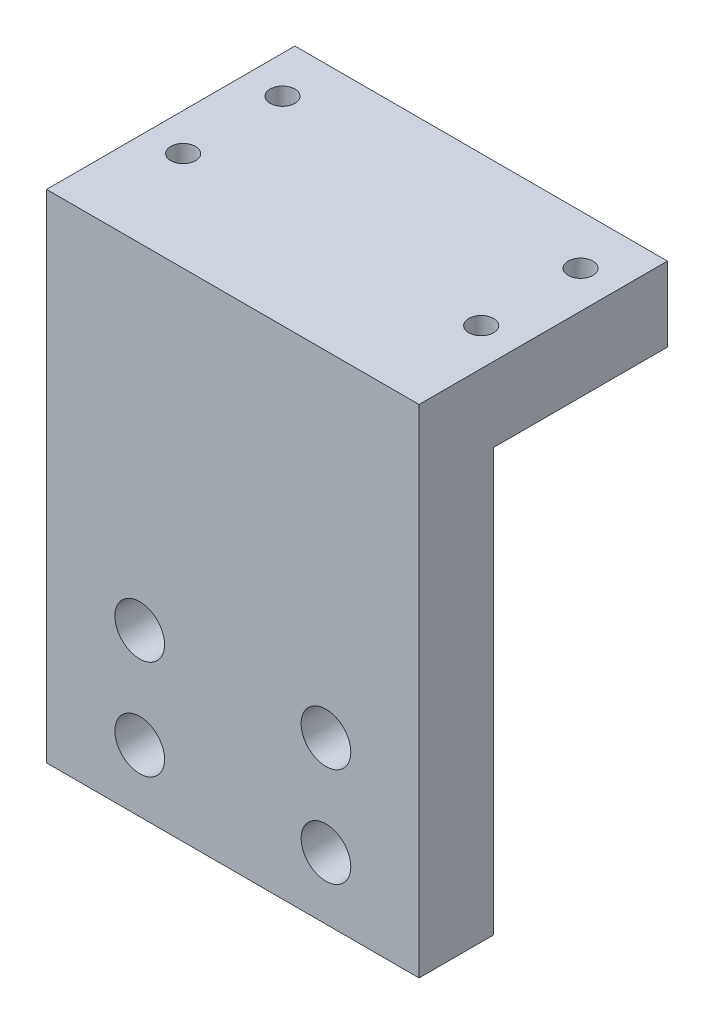
from build123d import *

# Parameters (mm, degrees)
BOSS_EXTRUDE1_DEPTH = 150
SKETCH2_R           = 10
CUT_EXTRUDE1_DEPTH  = 150
SKETCH3_R           = 5
CUT_EXTRUDE2_DEPTH  = 273.07833604


with BuildPart() as part:
    # Sketch1 → Boss-Extrude1 (new body)
    with BuildSketch(Plane(origin=(0, 0, 0), x_dir=(0, 0, -1), z_dir=(1, 0, 0))):
        Polygon((7.362101983, -50), (7.362101983, 150), (107.362101983, 150), (107.362101983, 120), (37.362101983, 120), (37.362101983, -50), align=None)
    extrude(amount=BOSS_EXTRUDE1_DEPTH)

    # Sketch2 → Cut-Extrude1 (cut)
    with BuildSketch(Plane.XY.offset(-7.362101983)):
        with Locations((37.5, -25)):
            Circle(SKETCH2_R)
        with Locations((37.5, 15)):
            Circle(SKETCH2_R)
        with Locations((112.5, -25)):
            Circle(SKETCH2_R)
        with Locations((112.5, 15)):
            Circle(SKETCH2_R)
    extrude(amount=-CUT_EXTRUDE1_DEPTH, mode=Mode.SUBTRACT)

    # Sketch3 → Cut-Extrude2 (cut, through all)
    with BuildSketch(Plane(origin=(0, 150, 0), x_dir=(1, 0, 0), z_dir=(0, 1, 0))):
        with Locations(Location((15, 87.362101983, 0), (0, 0, 270))):
            Circle(SKETCH3_R)
        with Locations(Location((15, 47.362101983, 0), (0, 0, 270))):
            Circle(SKETCH3_R)
        with Locations(Location((135, 47.362101983, 0), (0, 0, 270))):
            Circle(SKETCH3_R)
        with Locations(Location((135, 87.362101983, 0), (0, 0, 270))):
            Circle(SKETCH3_R)
    extrude(amount=-CUT_EXTRUDE2_DEPTH, mode=Mode.SUBTRACT)


solid = part.part
